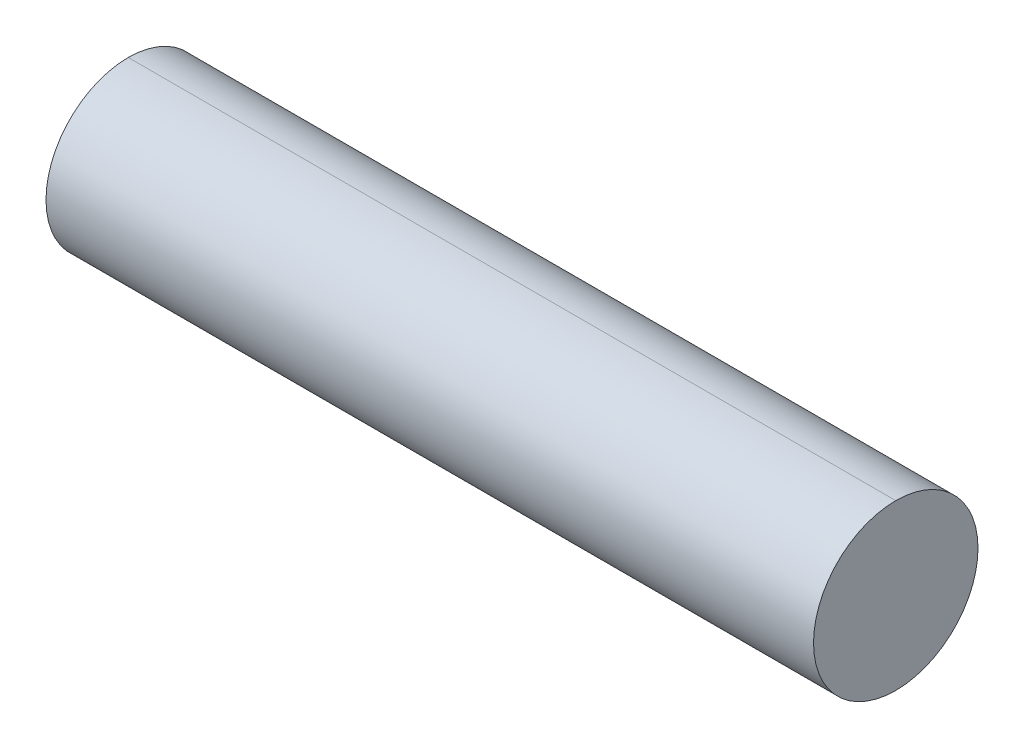
from build123d import *

# Parameters (mm, degrees)
SKETCH1_R           = 19.05
BOSS_EXTRUDE1_DEPTH = 177.8
SCALE1_SCALE        = 2.84


with BuildPart() as part:
    # Sketch1 → Boss-Extrude1 (new body)
    with BuildSketch(Plane(origin=(0, 0, 0), x_dir=(0, 0, -1), z_dir=(1, 0, 0))):
        Circle(SKETCH1_R)
    extrude(amount=BOSS_EXTRUDE1_DEPTH)


with BuildPart() as part_1:
    # Scale1: scaled about (88.9, 0, 0)
    add(part.part.scale(SCALE1_SCALE).moved(Location((-163.576, 0, 0))))


solid = part_1.part
